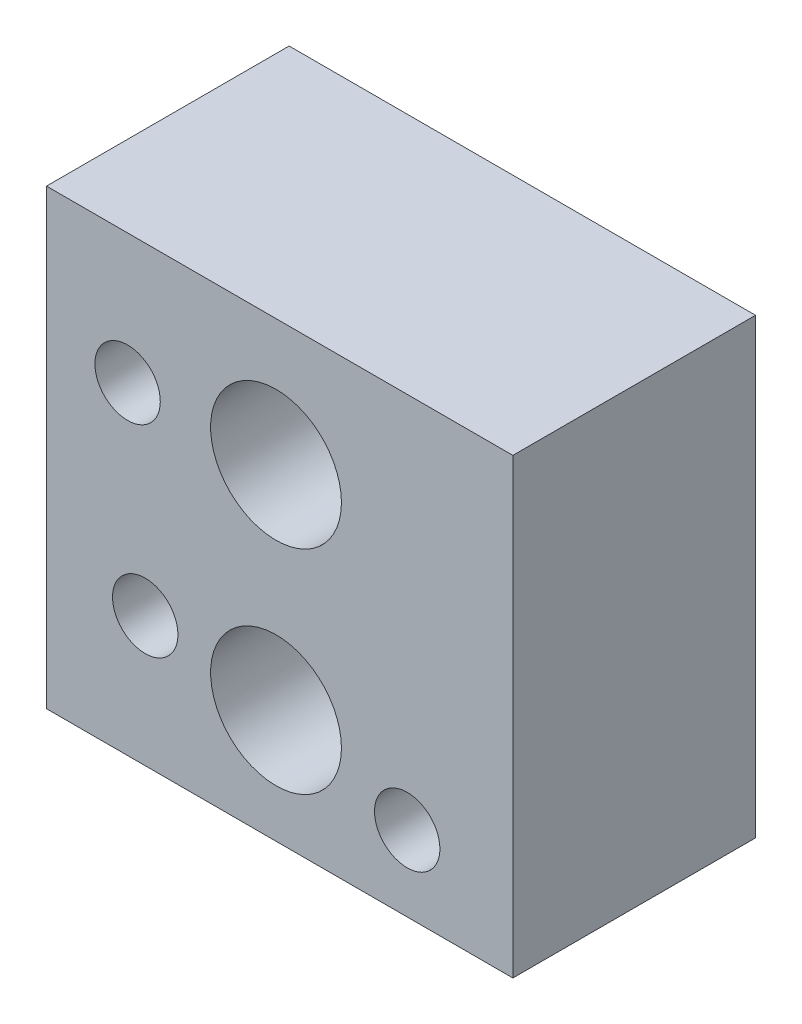
from build123d import *

# Parameters (mm, degrees)
SKETCH1_W      = 181.120085016
SKETCH1_H      = 175.775557917
EXTRUDE1_DEPTH = 94.234
SKETCH2_R      = 12.7
SKETCH2_R_2    = 25.4
EXTRUDE2_DEPTH = 169.081722796


with BuildPart() as part:
    # Sketch1 → Extrude1 (new body)
    with BuildSketch(Plane.XY):
        with Locations((-11.282890542, -6.977577045)):
            Rectangle(SKETCH1_W, SKETCH1_H)
    extrude(amount=EXTRUDE1_DEPTH)

    # Sketch2 → Extrude2 (cut, through all)
    with BuildSketch(Plane.XY.offset(94.234)):
        with Locations((-70.346687476, 30.541863944)):
            Circle(SKETCH2_R)
        with Locations((38.246940246, -65.633767766)):
            Circle(SKETCH2_R)
        with Locations((-63.5, -44.45)):
            Circle(SKETCH2_R)
        with Locations((-12.7, 31.75)):
            Circle(SKETCH2_R_2)
        with Locations((-12.7, -50.8)):
            Circle(SKETCH2_R_2)
    extrude(amount=-EXTRUDE2_DEPTH, mode=Mode.SUBTRACT)


solid = part.part
